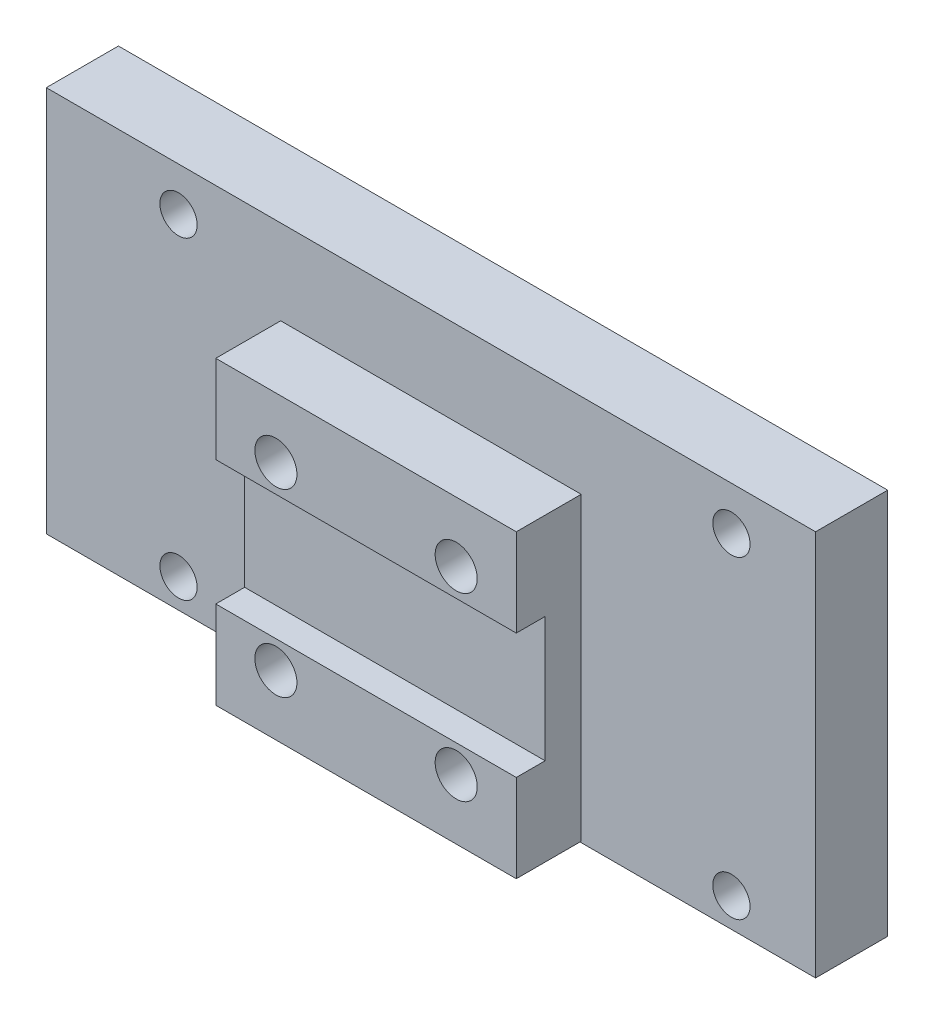
from build123d import *

# Parameters (mm, degrees)
SKETCH_1_W          = 25
SKETCH_1_H          = 25
SKETCH_1_R          = 1.75
EXTRUDE_1_DEPTH     = 3
SKETCH_2_W          = 25
SKETCH_2_H          = 7.3
EXTRUDE_2_DEPTH     = 2.4
SKETCH_3_R          = 1.75
CUT_EXTRUDE_1_DEPTH = 36.765346356
SKETCH_6_W          = 64
SKETCH_6_H          = 36.1
EXTRUDE_5_DEPTH     = 6
SKETCH_7_W          = 25
SKETCH_7_H          = 25
CUT_EXTRUDE_2_DEPTH = 5
SKETCH_8_R          = 1.55
CUT_EXTRUDE_3_DEPTH = 36
SKETCH_3_2_R        = 1.75
CUT_EXTRUDE_5_DEPTH = 57.012610187
SKETCH_9_W          = 64
SKETCH_9_H          = 3.95
CUT_EXTRUDE_6_DEPTH = 56.167494959


with BuildPart() as part:
    # 草图1 → 凸台-拉伸1 (new body)
    with BuildSketch(Plane.XY):
        with Locations((12.5, 12.5)):
            Rectangle(SKETCH_1_W, SKETCH_1_H)
        with Locations((5, 20)):
            Circle(SKETCH_1_R, mode=Mode.SUBTRACT)
        with Locations((20, 20)):
            Circle(SKETCH_1_R, mode=Mode.SUBTRACT)
        with Locations((5, 5)):
            Circle(SKETCH_1_R, mode=Mode.SUBTRACT)
        with Locations((20, 5)):
            Circle(SKETCH_1_R, mode=Mode.SUBTRACT)
    extrude(amount=EXTRUDE_1_DEPTH)

    # 草图2 → 凸台-拉伸2 (add)
    with BuildSketch(Plane.XY.offset(3)):
        with Locations((12.5, 21.35)):
            Rectangle(SKETCH_2_W, SKETCH_2_H)
        with Locations((12.5, 3.65)):
            Rectangle(SKETCH_2_W, SKETCH_2_H)
    extrude(amount=EXTRUDE_2_DEPTH)

    # 草图3 → 切除-拉伸1 (cut, through all)
    with BuildSketch(Plane.XY.offset(5.4)):
        with Locations((5, 5)):
            Circle(SKETCH_3_R)
        with Locations((20, 5)):
            Circle(SKETCH_3_R)
        with Locations((20, 20)):
            Circle(SKETCH_3_R)
        with Locations((5, 20)):
            Circle(SKETCH_3_R)
    extrude(amount=-CUT_EXTRUDE_1_DEPTH, mode=Mode.SUBTRACT)

    # 草图6 → 凸台-拉伸5 (add)
    with BuildSketch(Plane(origin=(0, 0, 0), x_dir=(-1, 0, 0), z_dir=(0, 0, -1))):
        with Locations((-12.5, 14)):
            Rectangle(SKETCH_6_W, SKETCH_6_H)
    extrude(amount=EXTRUDE_5_DEPTH)

    # 草图7 → 切除-拉伸2 (cut)
    with BuildSketch(Plane(origin=(0, 0, -6), x_dir=(-1, 0, 0), z_dir=(0, 0, -1))):
        with Locations((-12.5, 12.5)):
            Rectangle(SKETCH_7_W, SKETCH_7_H)
    extrude(amount=-CUT_EXTRUDE_2_DEPTH, mode=Mode.SUBTRACT)

    # 草图8 → 切除-拉伸3 (cut)
    with BuildSketch(Plane.XY):
        with Locations((37.5, 2.325837481)):
            Circle(SKETCH_8_R)
        with Locations((-8.5, 2.325837481)):
            Circle(SKETCH_8_R)
        with Locations((-8.5, 28.425837481)):
            Circle(SKETCH_8_R)
        with Locations((37.5, 28.425837481)):
            Circle(SKETCH_8_R)
    extrude(amount=-CUT_EXTRUDE_3_DEPTH, mode=Mode.SUBTRACT)

    # 草图3<2> → 切除-拉伸5 (cut, through all)
    with BuildSketch(Plane.XY.offset(5.4)):
        with Locations((5, 5)):
            Circle(SKETCH_3_2_R)
        with Locations((20, 5)):
            Circle(SKETCH_3_2_R)
        with Locations((20, 20)):
            Circle(SKETCH_3_2_R)
        with Locations((5, 20)):
            Circle(SKETCH_3_2_R)
    extrude(amount=-CUT_EXTRUDE_5_DEPTH, mode=Mode.SUBTRACT)

    # 草图9 → 切除-拉伸6 (cut, through all)
    with BuildSketch(Plane.XY):
        with Locations((12.5, -2.075)):
            Rectangle(SKETCH_9_W, SKETCH_9_H)
    extrude(amount=-CUT_EXTRUDE_6_DEPTH, mode=Mode.SUBTRACT)


solid = part.part
